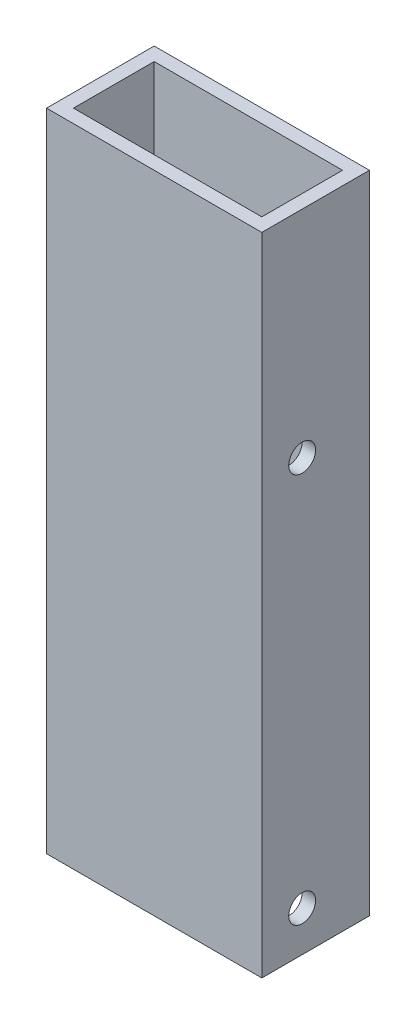
from build123d import *

# Parameters (mm, degrees)
SKETCH1_W           = 50.8
SKETCH1_H           = 25.4
SKETCH1_W_2         = 44.45
SKETCH1_H_2         = 19.05
BOSS_EXTRUDE1_DEPTH = 76.2
SKETCH2_R           = 3.175
CUT_EXTRUDE1_DEPTH  = 93.457395594


with BuildPart() as part:
    # Sketch1 → Boss-Extrude1 (new, symmetric)
    with BuildSketch(Plane(origin=(0, 0, 0), x_dir=(1, 0, 0), z_dir=(0, 1, 0))):
        Rectangle(SKETCH1_W, SKETCH1_H)
        Rectangle(SKETCH1_W_2, SKETCH1_H_2, mode=Mode.SUBTRACT)
    extrude(amount=BOSS_EXTRUDE1_DEPTH, both=True)

    # Sketch2 → Cut-Extrude1 (cut, through all)
    with BuildSketch(Plane.ZY.offset(25.4)):
        with Locations((3.175, -66.675)):
            Circle(SKETCH2_R)
        with Locations((3.175, 25.4)):
            Circle(SKETCH2_R)
    extrude(amount=-CUT_EXTRUDE1_DEPTH, mode=Mode.SUBTRACT)


solid = part.part
